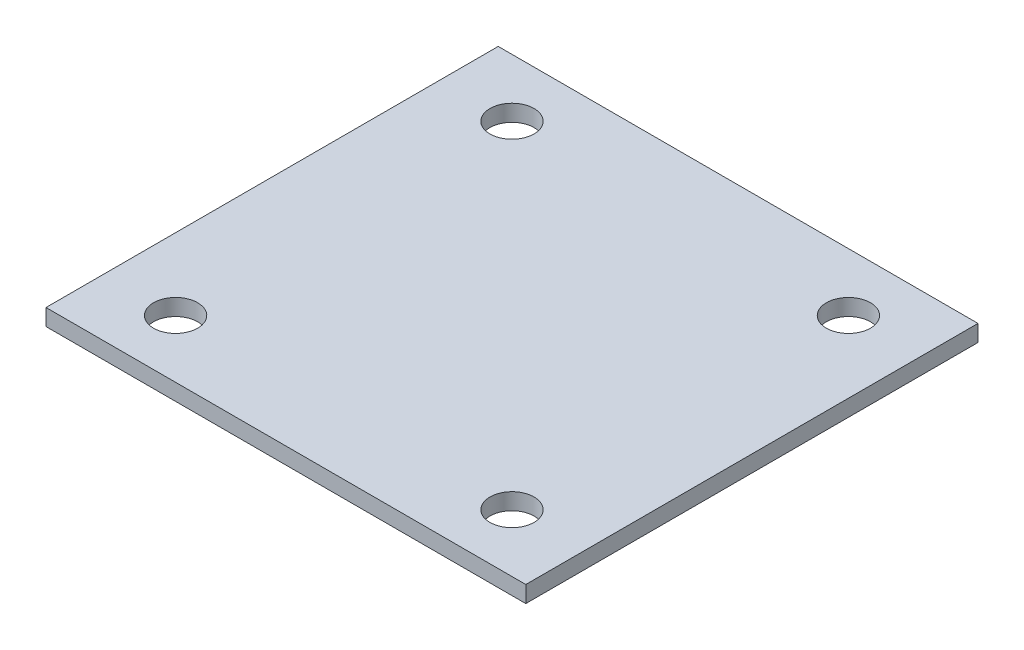
from build123d import *

# Parameters (mm, degrees)
SKETCH_1_W      = 43.5
SKETCH_1_H      = 41
SKETCH_1_R      = 2
EXTRUDE_1_DEPTH = 1.5


with BuildPart() as part:
    # 草图1 → 凸台-拉伸1 (new body)
    with BuildSketch(Plane(origin=(0, 0, 0), x_dir=(1, 0, 0), z_dir=(0, 1, 0))):
        Rectangle(SKETCH_1_W, SKETCH_1_H)
        with Locations(Location((-15.25, 15.25, 0), (0, 0, 270))):
            Circle(SKETCH_1_R, mode=Mode.SUBTRACT)
        with Locations(Location((15.25, 15.25, 0), (0, 0, 90))):
            Circle(SKETCH_1_R, mode=Mode.SUBTRACT)
        with Locations(Location((15.25, -15.25, 0), (0, 0, 270))):
            Circle(SKETCH_1_R, mode=Mode.SUBTRACT)
        with Locations(Location((-15.25, -15.25, 0), (0, 0, 90))):
            Circle(SKETCH_1_R, mode=Mode.SUBTRACT)
    extrude(amount=EXTRUDE_1_DEPTH)


solid = part.part
